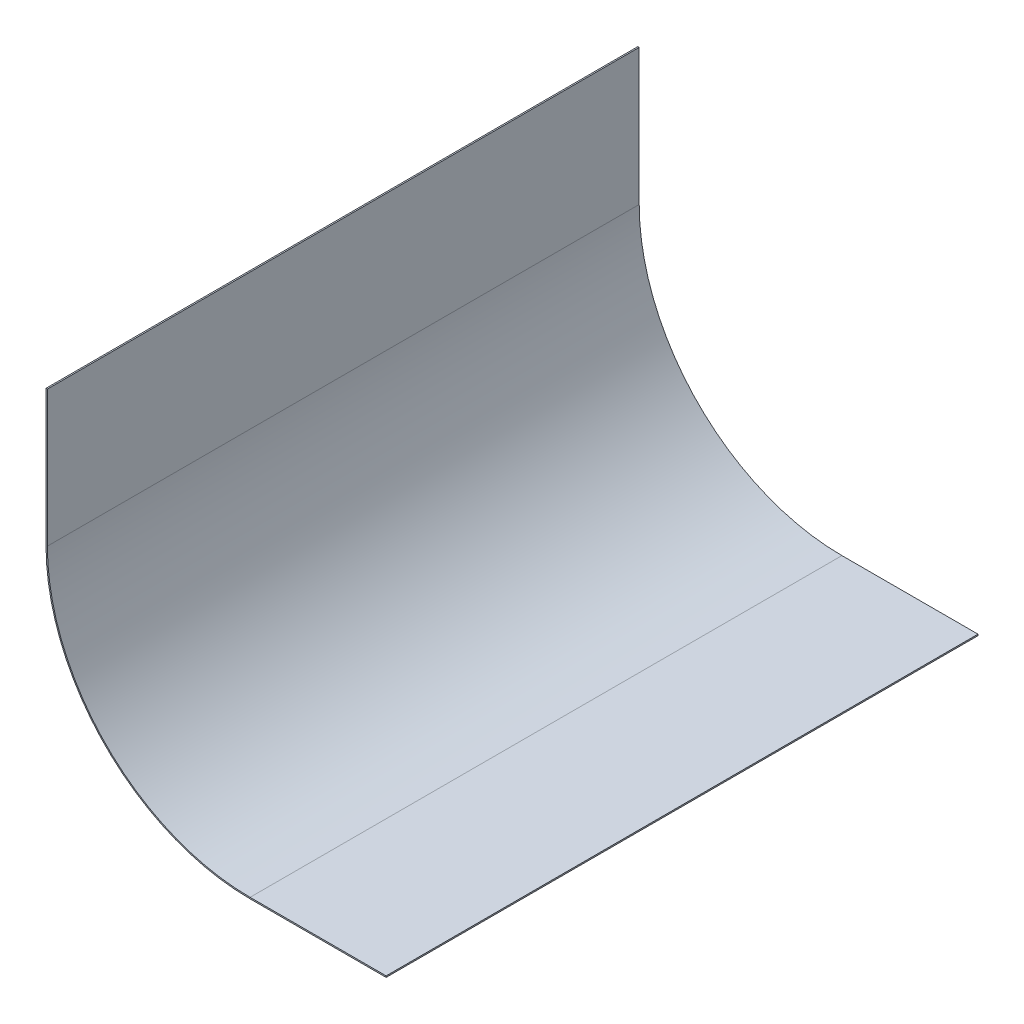
from build123d import *

# Parameters (mm, degrees)
BOSS_EXTRUDE1_DEPTH = 490
SKETCH3_W           = 307.381871045
SKETCH3_H           = 276.781214979
CUT_EXTRUDE1_DEPTH  = 55


with BuildPart() as part:
    # Sketch1 → Boss-Extrude1 (new body)
    with BuildSketch(Plane.XY):
        with BuildLine():
            Line((-42.896935933, 250), (-42.896935933, 150))
            ThreePointArc((-42.896935933, 150), (1.037046889, 43.933982822), (107.103064067, 0))
            Line((107.103064067, 0), (207.103064067, 0))
            Line((207.103064067, 0), (207.103064067, 1))
            Line((207.103064067, 1), (107.103064067, 1))
            ThreePointArc((107.103064067, 1), (1.74415367, 44.641089603), (-41.896935933, 150))
            Line((-41.896935933, 150), (-41.896935933, 250))
            Line((-41.896935933, 250), (-42.896935933, 250))
        make_face()
    extrude(amount=BOSS_EXTRUDE1_DEPTH)

    # Sketch3 → Cut-Extrude1 (cut)
    with BuildSketch(Plane.XY.offset(490)):
        with Locations((90.01109878, 115.028999709)):
            Rectangle(SKETCH3_W, SKETCH3_H)
    extrude(amount=-CUT_EXTRUDE1_DEPTH, mode=Mode.SUBTRACT)


solid = part.part
